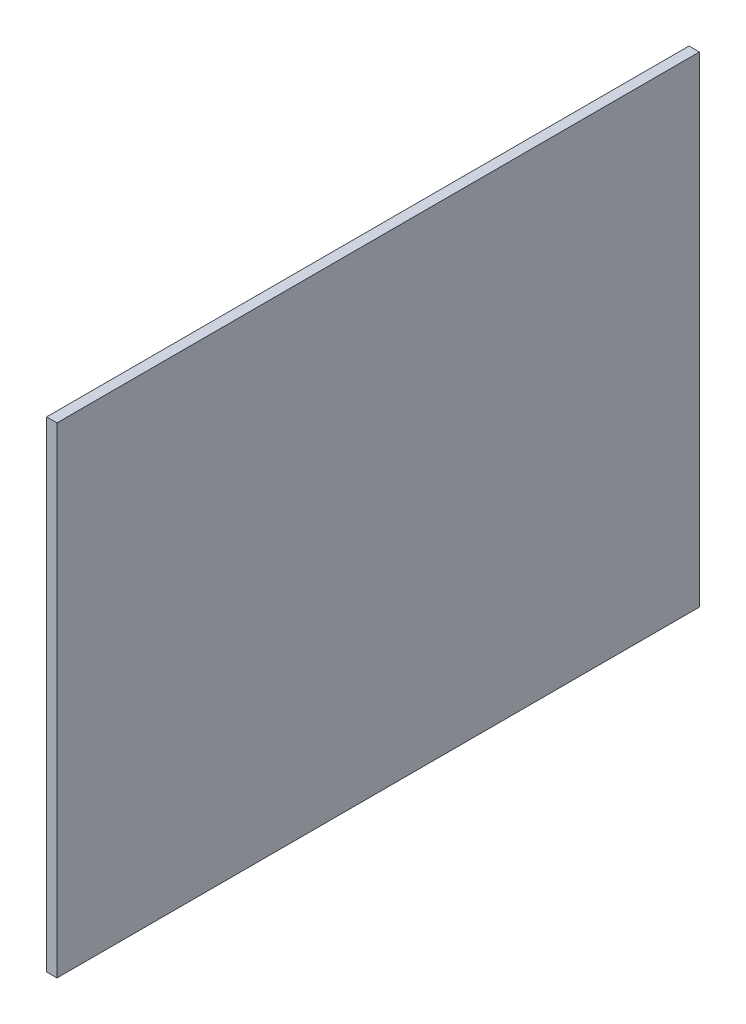
from build123d import *

# Parameters (mm, degrees)
SKETCH1_W           = 1.5875
SKETCH1_H           = 73.66
BOSS_EXTRUDE1_DEPTH = 98.425


with BuildPart() as part:
    # Sketch1 → Boss-Extrude1 (new body)
    with BuildSketch(Plane.XY):
        with Locations((0.79375, 36.83)):
            Rectangle(SKETCH1_W, SKETCH1_H)
    extrude(amount=BOSS_EXTRUDE1_DEPTH)


solid = part.part
